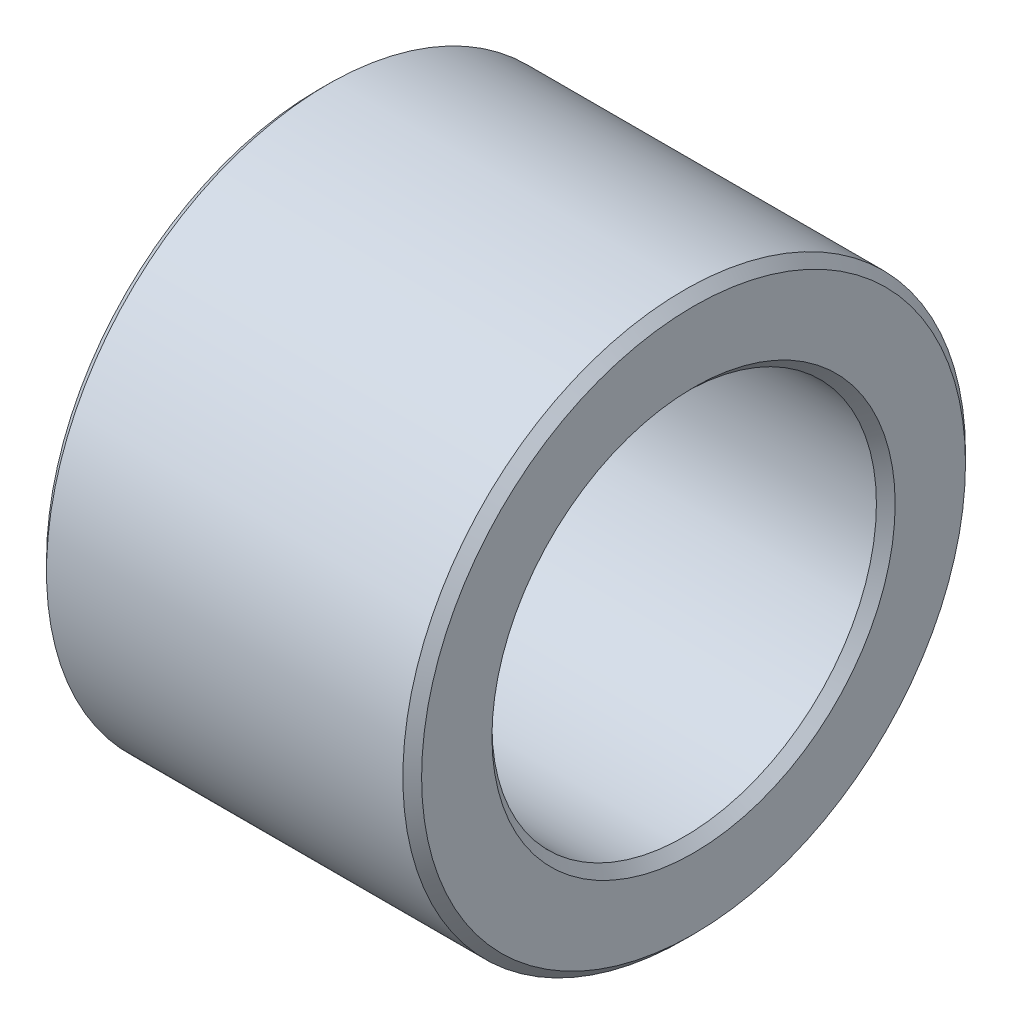
from build123d import *

# Parameters (mm, degrees)
SKETCH_1_R      = 3
SKETCH_1_R_2    = 2.05
EXTRUDE_1_DEPTH = 4
CHAMFER_1_SIZE  = 0.1


with BuildPart() as part:
    # 草图1 → 凸台-拉伸1 (new body)
    with BuildSketch(Plane.YZ):
        with Locations(Location((0, 0, 0), (0, 0, 270))):
            Circle(SKETCH_1_R)
        with Locations(Location((0, 0, 0), (0, 0, 270))):
            Circle(SKETCH_1_R_2, mode=Mode.SUBTRACT)
    extrude(amount=EXTRUDE_1_DEPTH)

    # 倒角1
    chamfer_1_edges = [part.edges().sort_by_distance(p)[0] for p in [
        (0, 0, 3),
        (4, 0, 3),
        (0, 0, 2.05),
        (4, 0, 2.05),
    ]]
    chamfer(chamfer_1_edges, length=CHAMFER_1_SIZE)


solid = part.part
